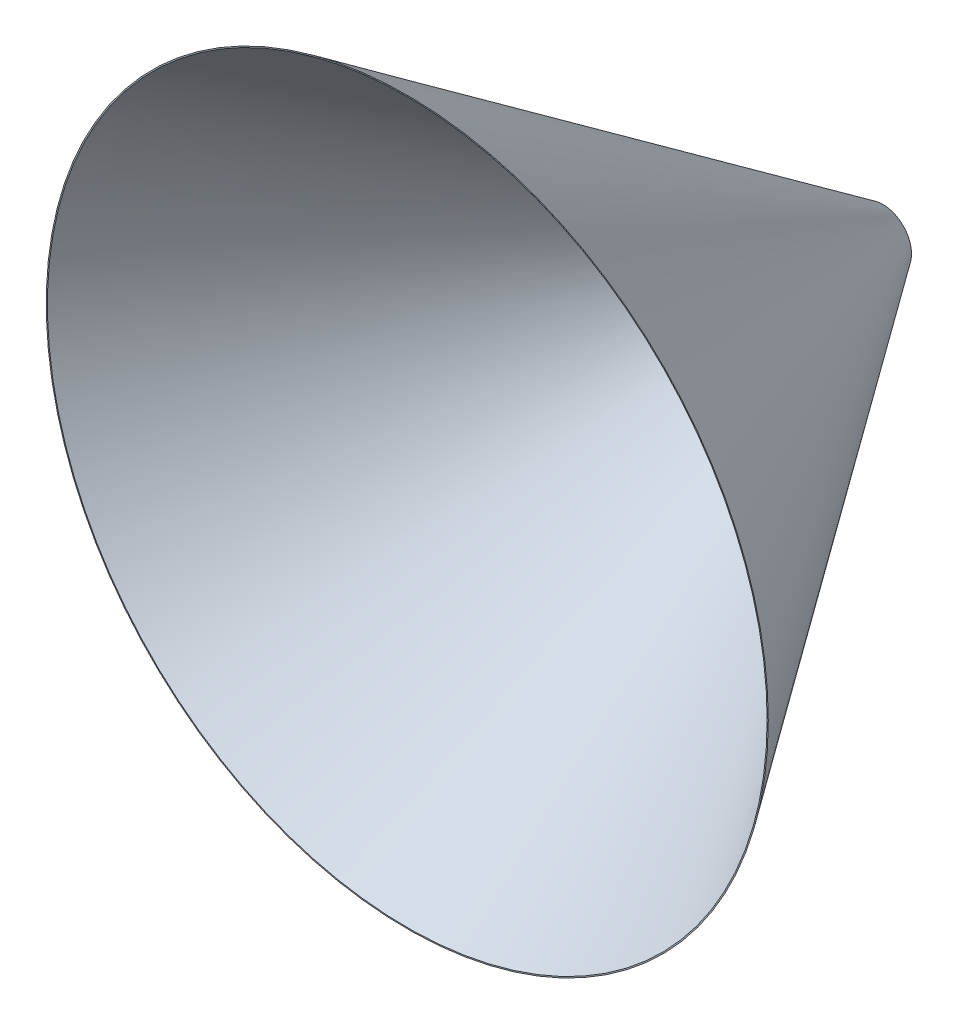
from build123d import *

# Parameters (mm, degrees)
SKETCH_1_R      = 3
EXTRUDE_1_DEPTH = 50
EXTRUDE_1_DRAFT = -34.95
SHELL_1_T       = -0.1


with BuildPart() as part:
    # 草图1 → 凸台-拉伸1 (with draft: the straight prism first)
    with BuildSketch(Plane.XY):
        Circle(SKETCH_1_R)
    extrude(amount=EXTRUDE_1_DEPTH)
    # 凸台-拉伸1: the draft: its side faces are tilted about the plane it starts from
    extrude_1_sides = [part.faces().sort_by_distance(p)[0] for p in [
        (-3, 0, 25),
    ]]
    draft(extrude_1_sides, Plane.XY, EXTRUDE_1_DRAFT)

    # 抽壳1
    shell_1_openings = [part.faces().sort_by_distance(p)[0] for p in [
        (0, 0, 50),
        (0, 0, 0),
    ]]
    offset(amount=SHELL_1_T, openings=shell_1_openings, kind=Kind.INTERSECTION)


solid = part.part
